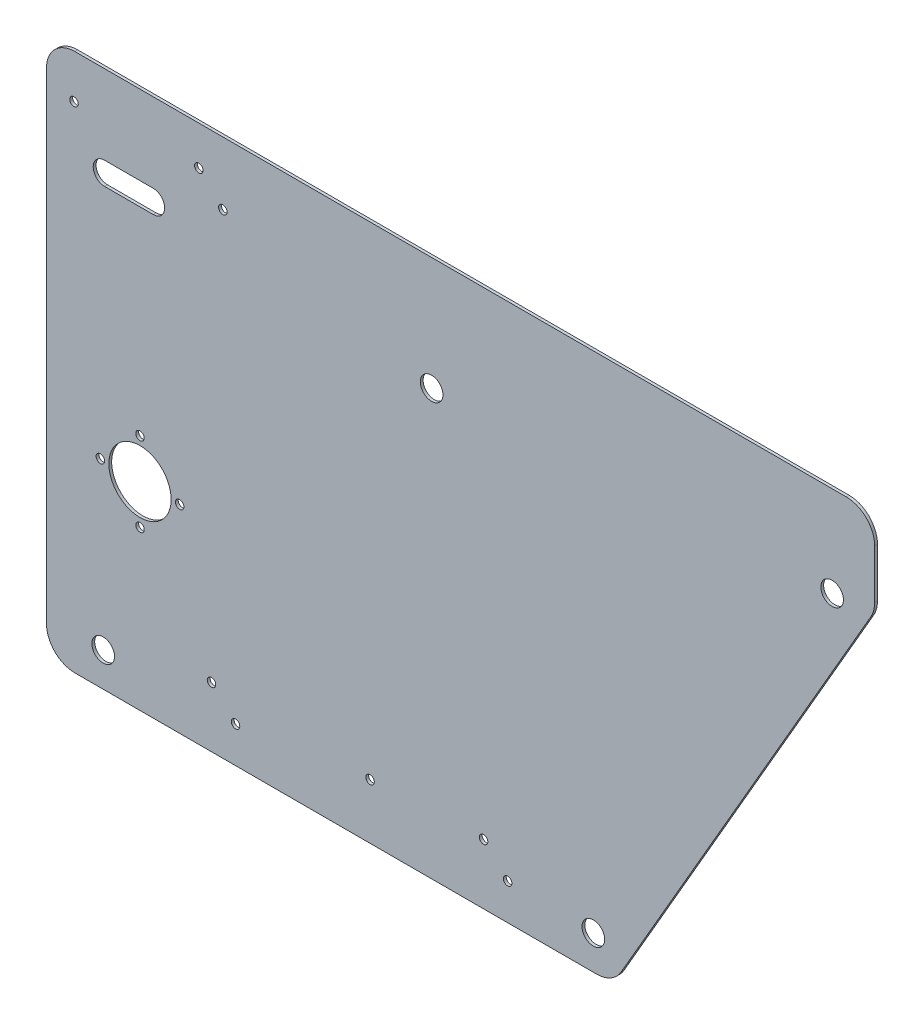
from build123d import *

# Parameters (mm, degrees)
SKETCH1_W           = 200
SKETCH1_H           = 160
SKETCH1_W_2         = 292.37604307
SKETCH1_H_2         = 30
BOSS_EXTRUDE1_DEPTH = 1
FILLET1_R           = 10
SKETCH2_R           = 4
SKETCH2_R_2         = 11
SKETCH2_R_3         = 1.5
CUT_EXTRUDE1_DEPTH  = 3


with BuildPart() as part:
    # Sketch1 → Boss-Extrude1 (new body)
    with BuildSketch(Plane.XY):
        Rectangle(SKETCH1_W, SKETCH1_H)
        Polygon((192.37604307, 80), (100, -80), (100, 80), align=None)
        with Locations((46.188021535, 95)):
            Rectangle(SKETCH1_W_2, SKETCH1_H_2)
    extrude(amount=BOSS_EXTRUDE1_DEPTH)

    # Fillet1
    fillet1_edges = [part.edges().sort_by_distance(p)[0] for p in [
        (-100, 110, 0.5),
        (192.37604307, 110, 0.5),
        (-100, -80, 0.5),
        (192.37604307, 80, 0.5),
        (100, -80, 0.5),
    ]]
    fillet(fillet1_edges, radius=FILLET1_R)

    # Sketch2 → Cut-Extrude1 (cut)
    with BuildSketch(Plane.XY.offset(1)):
        with Locations((93.07179677, -68)):
            Circle(SKETCH2_R)
        with Locations((177.364936071, 78)):
            Circle(SKETCH2_R)
        with Locations((-67, -10)):
            Circle(SKETCH2_R_2)
        with Locations((-80, -68)):
            Circle(SKETCH2_R)
        with Locations((-53, -10)):
            Circle(SKETCH2_R_3)
        with Locations((-67, 4)):
            Circle(SKETCH2_R_3)
        with Locations((-81, -10)):
            Circle(SKETCH2_R_3)
        with Locations((-67, -24)):
            Circle(SKETCH2_R_3)
        with Locations((35.957265033, 70)):
            Circle(SKETCH2_R)
        with Locations((62.79605759, -67.242640687)):
            Circle(SKETCH2_R_3)
        with Locations((54.310776216, -58.757359313)):
            Circle(SKETCH2_R_3)
        with Locations((-33.274226936, -67.242640687)):
            Circle(SKETCH2_R_3)
        with Locations((-41.75950831, -58.757359313)):
            Circle(SKETCH2_R_3)
        with Locations((14.225855729, -60.5)):
            Circle(SKETCH2_R_3)
        with Locations((-37.754710439, 87.757359313)):
            Circle(SKETCH2_R_3)
        with Locations((-46.239991813, 96.242640687)):
            Circle(SKETCH2_R_3)
        with Locations((-90.295627115, 94.5)):
            Circle(SKETCH2_R_3)
        with BuildLine():
            Line((-79.516586773, 82), (-62.300333374, 82))
            ThreePointArc((-62.300333374, 82), (-58.300333374, 78), (-62.300333374, 74))
            Line((-62.300333374, 74), (-79.516586773, 74))
            ThreePointArc((-79.516586773, 74), (-83.516586773, 78), (-79.516586773, 82))
        make_face()
    extrude(amount=-CUT_EXTRUDE1_DEPTH, mode=Mode.SUBTRACT)


solid = part.part
